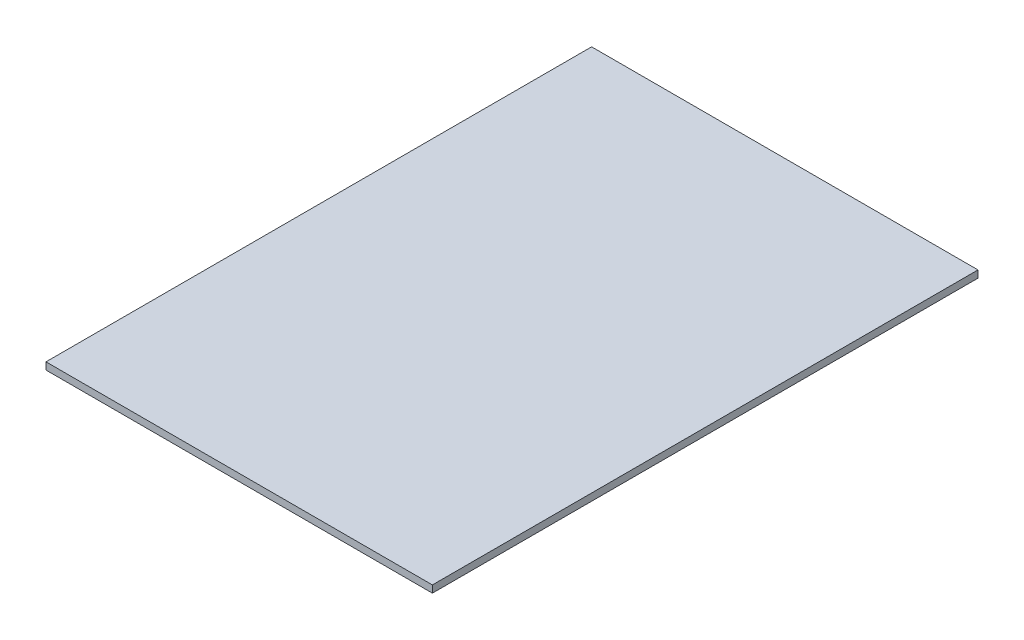
from build123d import *

# Parameters (mm, degrees)
CROQUIS1_W              = 216
CROQUIS1_H              = 310
SALIENTE_EXTRUIR1_DEPTH = 4
CROQUIS2_W              = 216
CROQUIS2_H              = 2.5
CORTAR_EXTRUIR1_DEPTH   = 4


with BuildPart() as part:
    # Croquis1 → Saliente-Extruir1 (new body)
    with BuildSketch(Plane(origin=(0, 0, 0), x_dir=(1, 0, 0), z_dir=(0, 1, 0))):
        Rectangle(CROQUIS1_W, CROQUIS1_H)
    extrude(amount=SALIENTE_EXTRUIR1_DEPTH)

    # Croquis2 → Cortar-Extruir1 (cut)
    with BuildSketch(Plane(origin=(0, 4, 0), x_dir=(1, 0, 0), z_dir=(0, 1, 0))):
        with Locations((0, 153.75)):
            Rectangle(CROQUIS2_W, CROQUIS2_H)
        with Locations((0, -153.75)):
            Rectangle(CROQUIS2_W, CROQUIS2_H)
    extrude(amount=-CORTAR_EXTRUIR1_DEPTH, mode=Mode.SUBTRACT)


solid = part.part
